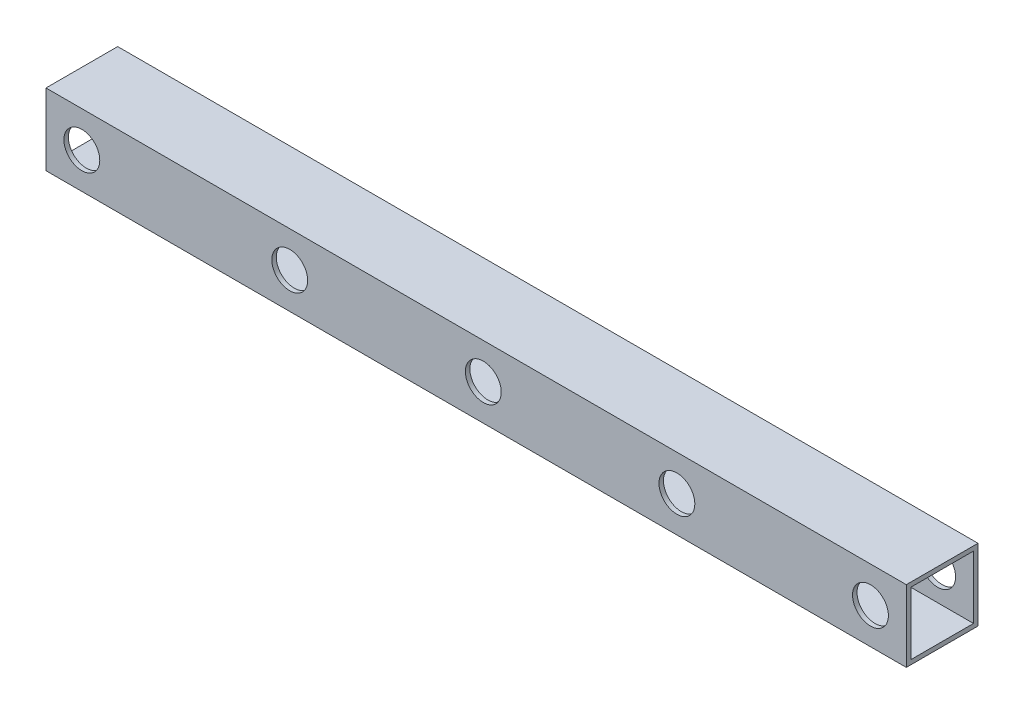
from build123d import *

# Parameters (mm, degrees)
SKETCH1_W                 = 304.8
SKETCH1_H                 = 25.4
BOSS_EXTRUDE1_DEPTH       = 25.4
SKETCH2_W                 = 22.225
SKETCH2_H                 = 22.225
CUT_EXTRUDE1_DEPTH        = 307.909367729
SKETCH3_W                 = 6.35
SKETCH3_H                 = 29.5275
HOLE1_AT_2_COUNT          = 2
HOLE1_AT_2_PITCH          = 279.4
HOLE2_D                   = 12.7
HOLE2_DEPTH               = 25.4
LPATTERN1_COUNT           = 2
LPATTERN1_PITCH           = 27.94
LPATTERN1_COUNT_DIR2      = 4
LPATTERN1_PITCH_DIR2      = 68.58
LPATTERN1_COPY_1_SKETCH_W = 6.35
LPATTERN1_COPY_1_SKETCH_H = 29.5275
LPATTERN1_COPY_2_SKETCH_W = 6.35
LPATTERN1_COPY_2_SKETCH_H = 29.5275
LPATTERN1_COPY_3_SKETCH_W = 6.35
LPATTERN1_COPY_3_SKETCH_H = 29.5275
LPATTERN1_COPY_4_SKETCH_W = 6.35
LPATTERN1_COPY_4_SKETCH_H = 29.5275
LPATTERN1_COPY_5_SKETCH_W = 6.35
LPATTERN1_COPY_5_SKETCH_H = 29.5275
LPATTERN1_COPY_6_SKETCH_W = 6.35
LPATTERN1_COPY_6_SKETCH_H = 29.5275
LPATTERN1_COPY_7_SKETCH_W = 6.35
LPATTERN1_COPY_7_SKETCH_H = 29.5275


with BuildPart() as part:
    # Sketch1 → Boss-Extrude1 (new body)
    with BuildSketch(Plane(origin=(0, 0, 0), x_dir=(1, 0, 0), z_dir=(0, 1, 0))):
        with Locations((152.4, 12.7)):
            Rectangle(SKETCH1_W, SKETCH1_H)
    extrude(amount=-BOSS_EXTRUDE1_DEPTH)

    # Sketch2 → Cut-Extrude1 (cut, through all)
    with BuildSketch(Plane.ZY):
        with Locations((-12.7, -12.7)):
            Rectangle(SKETCH2_W, SKETCH2_H)
    extrude(amount=-CUT_EXTRUDE1_DEPTH, mode=Mode.SUBTRACT)

    # Sketch3 → Hole1 (revolve, cut)
    with BuildSketch(Plane(origin=(292.1, -12.7, -23.8125), x_dir=(0, -1, 0), z_dir=(1, 0, 0))):
        with Locations((3.175, 14.76375)):
            Rectangle(SKETCH3_W, SKETCH3_H)
    hole1 = revolve(axis=Axis((292.1, -12.7, -133.8125), (0, 0, 1)), mode=Mode.SUBTRACT)

    # Hole1 at 2: Hole1 ×2
    with Locations(*[(-i * HOLE1_AT_2_PITCH, 0, 0) for i in range(1, HOLE1_AT_2_COUNT)]):
        add(hole1, mode=Mode.SUBTRACT)

    # Hole2
    with Locations(Plane.XY):
        with Locations((292.1, -12.7), (12.7, -12.7)):
            Hole(HOLE2_D / 2, depth=HOLE2_DEPTH)

    # LPattern1: Hole1 2 × 4
    with Locations(*[(-j * LPATTERN1_PITCH_DIR2, 0, i * LPATTERN1_PITCH) for i in range(LPATTERN1_COUNT) for j in range(LPATTERN1_COUNT_DIR2) if (i, j) != (0, 0)]):
        add(hole1, mode=Mode.SUBTRACT)

    # LPattern1 copy 1 sketch → LPattern1 copy 1 (revolve, cut)
    with BuildSketch(Plane(origin=(-55.88, -12.7, -23.8125), x_dir=(0, -1, 0), z_dir=(1, 0, 0))):
        with Locations((3.175, 14.76375)):
            Rectangle(LPATTERN1_COPY_1_SKETCH_W, LPATTERN1_COPY_1_SKETCH_H)
    revolve(axis=Axis((-55.88, -12.7, -133.8125), (0, 0, 1)), mode=Mode.SUBTRACT)

    # LPattern1 copy 2 sketch → LPattern1 copy 2 (revolve, cut)
    with BuildSketch(Plane(origin=(-124.46, -12.7, -23.8125), x_dir=(0, -1, 0), z_dir=(1, 0, 0))):
        with Locations((3.175, 14.76375)):
            Rectangle(LPATTERN1_COPY_2_SKETCH_W, LPATTERN1_COPY_2_SKETCH_H)
    revolve(axis=Axis((-124.46, -12.7, -133.8125), (0, 0, 1)), mode=Mode.SUBTRACT)

    # LPattern1 copy 3 sketch → LPattern1 copy 3 (revolve, cut)
    with BuildSketch(Plane(origin=(-193.04, -12.7, -23.8125), x_dir=(0, -1, 0), z_dir=(1, 0, 0))):
        with Locations((3.175, 14.76375)):
            Rectangle(LPATTERN1_COPY_3_SKETCH_W, LPATTERN1_COPY_3_SKETCH_H)
    revolve(axis=Axis((-193.04, -12.7, -133.8125), (0, 0, 1)), mode=Mode.SUBTRACT)

    # LPattern1 copy 4 sketch → LPattern1 copy 4 (revolve, cut)
    with BuildSketch(Plane(origin=(12.7, -12.7, 4.1275), x_dir=(0, -1, 0), z_dir=(1, 0, 0))):
        with Locations((3.175, 14.76375)):
            Rectangle(LPATTERN1_COPY_4_SKETCH_W, LPATTERN1_COPY_4_SKETCH_H)
    revolve(axis=Axis((12.7, -12.7, -105.8725), (0, 0, 1)), mode=Mode.SUBTRACT)

    # LPattern1 copy 5 sketch → LPattern1 copy 5 (revolve, cut)
    with BuildSketch(Plane(origin=(-55.88, -12.7, 4.1275), x_dir=(0, -1, 0), z_dir=(1, 0, 0))):
        with Locations((3.175, 14.76375)):
            Rectangle(LPATTERN1_COPY_5_SKETCH_W, LPATTERN1_COPY_5_SKETCH_H)
    revolve(axis=Axis((-55.88, -12.7, -105.8725), (0, 0, 1)), mode=Mode.SUBTRACT)

    # LPattern1 copy 6 sketch → LPattern1 copy 6 (revolve, cut)
    with BuildSketch(Plane(origin=(-124.46, -12.7, 4.1275), x_dir=(0, -1, 0), z_dir=(1, 0, 0))):
        with Locations((3.175, 14.76375)):
            Rectangle(LPATTERN1_COPY_6_SKETCH_W, LPATTERN1_COPY_6_SKETCH_H)
    revolve(axis=Axis((-124.46, -12.7, -105.8725), (0, 0, 1)), mode=Mode.SUBTRACT)

    # LPattern1 copy 7 sketch → LPattern1 copy 7 (revolve, cut)
    with BuildSketch(Plane(origin=(-193.04, -12.7, 4.1275), x_dir=(0, -1, 0), z_dir=(1, 0, 0))):
        with Locations((3.175, 14.76375)):
            Rectangle(LPATTERN1_COPY_7_SKETCH_W, LPATTERN1_COPY_7_SKETCH_H)
    revolve(axis=Axis((-193.04, -12.7, -105.8725), (0, 0, 1)), mode=Mode.SUBTRACT)


solid = part.part
